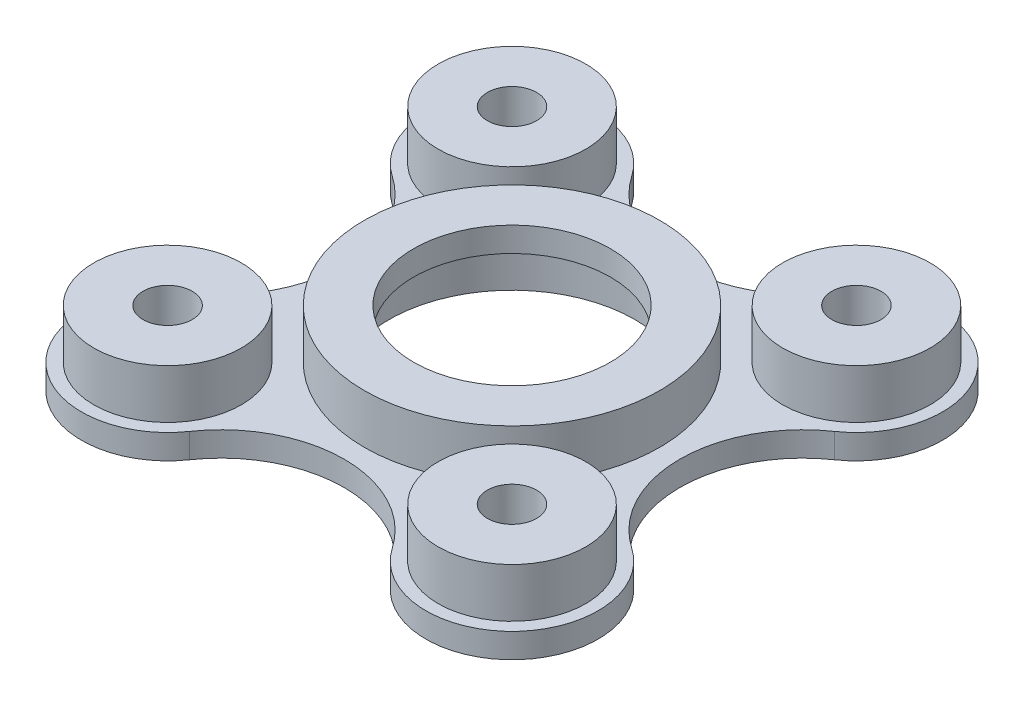
from build123d import *

# Parameters (mm, degrees)
SKETCH1_R           = 1
SKETCH1_R_2         = 5
BOSS_EXTRUDE1_DEPTH = 1
SKETCH3_R           = 6
BOSS_EXTRUDE2_DEPTH = 2
SKETCH4_R           = 5
CUT_EXTRUDE1_DEPTH  = 1
SKETCH5_R           = 4
CUT_EXTRUDE2_DEPTH  = 1
SKETCH6_R           = 3
BOSS_EXTRUDE3_DEPTH = 2
SKETCH7_R           = 1
CUT_EXTRUDE3_DEPTH  = 2


with BuildPart() as part:
    # Sketch1 → Boss-Extrude1 (new body)
    with BuildSketch(Plane(origin=(0, 0, 0), x_dir=(1, 0, 0), z_dir=(0, 1, 0))):
        with BuildLine():
            ThreePointArc((4.117647059, 8.98545751), (0, 6.82182538), (-4.117647059, 8.98545751))
            ThreePointArc((-4.117647059, 8.98545751), (-9.474873734, 9.474873734), (-8.98545751, 4.117647059))
            ThreePointArc((-8.98545751, 4.117647059), (-6.82182538, 0), (-8.98545751, -4.117647059))
            ThreePointArc((-8.98545751, -4.117647059), (-9.474873734, -9.474873734), (-4.117647059, -8.98545751))
            ThreePointArc((-4.117647059, -8.98545751), (0, -6.82182538), (4.117647059, -8.98545751))
            ThreePointArc((4.117647059, -8.98545751), (9.474873734, -9.474873734), (8.98545751, -4.117647059))
            ThreePointArc((8.98545751, -4.117647059), (6.82182538, 0), (8.98545751, 4.117647059))
            ThreePointArc((8.98545751, 4.117647059), (9.474873734, 9.474873734), (4.117647059, 8.98545751))
        make_face()
        with Locations((-7, -7)):
            Circle(SKETCH1_R, mode=Mode.SUBTRACT)
        Circle(SKETCH1_R_2, mode=Mode.SUBTRACT)
        with Locations((7, -7)):
            Circle(SKETCH1_R, mode=Mode.SUBTRACT)
        with Locations((-7, 7)):
            Circle(SKETCH1_R, mode=Mode.SUBTRACT)
        with Locations((7, 7)):
            Circle(SKETCH1_R, mode=Mode.SUBTRACT)
    extrude(amount=BOSS_EXTRUDE1_DEPTH)

    # Sketch3 → Boss-Extrude2 (add)
    with BuildSketch(Plane(origin=(0, 1, 0), x_dir=(1, 0, 0), z_dir=(0, 1, 0))):
        Circle(SKETCH3_R)
    extrude(amount=BOSS_EXTRUDE2_DEPTH)

    # Sketch4 → Cut-Extrude1 (cut)
    with BuildSketch(Plane.XZ.offset(-1)):
        Circle(SKETCH4_R)
    extrude(amount=-CUT_EXTRUDE1_DEPTH, mode=Mode.SUBTRACT)

    # Sketch5 → Cut-Extrude2 (cut)
    with BuildSketch(Plane.XZ.offset(-2)):
        Circle(SKETCH5_R)
    extrude(amount=-CUT_EXTRUDE2_DEPTH, mode=Mode.SUBTRACT)

    # Sketch6 → Boss-Extrude3 (add)
    with BuildSketch(Plane(origin=(0, 1, 0), x_dir=(1, 0, 0), z_dir=(0, 1, 0))):
        with Locations((-7, 7)):
            Circle(SKETCH6_R)
        with Locations((7, 7)):
            Circle(SKETCH6_R)
        with Locations((7, -7)):
            Circle(SKETCH6_R)
        with Locations((-7, -7)):
            Circle(SKETCH6_R)
    extrude(amount=BOSS_EXTRUDE3_DEPTH)

    # Sketch7 → Cut-Extrude3 (cut)
    with BuildSketch(Plane.XZ.offset(-1)):
        with Locations((-7, 7)):
            Circle(SKETCH7_R)
        with Locations((7, 7)):
            Circle(SKETCH7_R)
        with Locations((7, -7)):
            Circle(SKETCH7_R)
        with Locations((-7, -7)):
            Circle(SKETCH7_R)
    extrude(amount=-CUT_EXTRUDE3_DEPTH, mode=Mode.SUBTRACT)


solid = part.part
